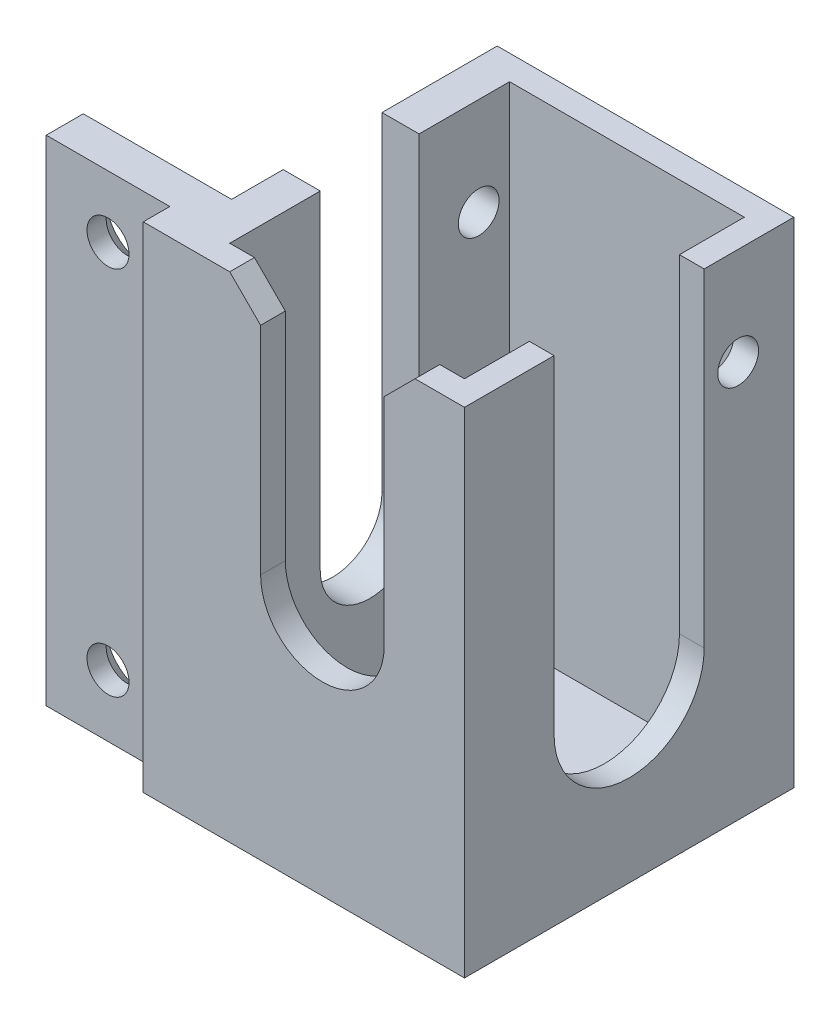
from build123d import *

# Parameters (mm, degrees)
SKETCH1_W                                       = 19
SKETCH1_H                                       = 22.65
BOSS_EXTRUDE1_DEPTH                             = 40
SKETCH2_W                                       = 3.46
SKETCH2_H                                       = 5.5
BOSS_EXTRUDE2_DEPTH                             = 0.7
CUT_EXTRUDE1_DEPTH                              = 3
CUT_EXTRUDE2_DEPTH                              = 2
CUT_EXTRUDE3_DEPTH                              = 2
CUT_EXTRUDE4_DEPTH                              = 12
CSK_FOR_M3_FLAT_HEAD_MACHINE_SCREW2_D           = 3.4
CSK_FOR_M3_FLAT_HEAD_MACHINE_SCREW2_DEPTH       = 14.978536948
CSK_FOR_M3_FLAT_HEAD_MACHINE_SCREW2_CSINK_D     = 6.3
CSK_FOR_M3_FLAT_HEAD_MACHINE_SCREW2_CSINK_ANGLE = 90
CSK_FOR_M3_FLAT_HEAD_MACHINE_SCREW2_TIP         = 1.021463052
CHAMFER3_SIZE                                   = 2.5
CUT_EXTRUDE5_DEPTH                              = 49.513458184
CUT_EXTRUDE5_DEPTH_BACK                         = 49.513458184
SKETCH14_R                                      = 1.65


with BuildPart() as part:
    # Sketch1 → Boss-Extrude1 (new body)
    with BuildSketch(Plane(origin=(0, 0, 0), x_dir=(1, 0, 0), z_dir=(0, 1, 0))):
        Polygon((-14.5, -13.325), (11.5, -13.325), (11.5, 13.325), (-12.5, 13.325), (-12.5, -8.175), (-24.5, -8.175), (-24.5, -11.175), (-14.5, -11.175), align=None)
        Rectangle(SKETCH1_W, SKETCH1_H, mode=Mode.SUBTRACT)
    extrude(amount=BOSS_EXTRUDE1_DEPTH)

    # Sketch2 → Boss-Extrude2 (add)
    with BuildSketch(Plane.XZ):
        Polygon((-14.5, 13.325), (-14.5, 11.175), (-24.5, 11.175), (-24.5, 8.175), (-12.5, 8.175), (-12.5, -13.325), (11.5, -13.325), (11.5, 13.325), align=None)
        Rectangle(SKETCH2_W, SKETCH2_H, mode=Mode.SUBTRACT)
    extrude(amount=-BOSS_EXTRUDE2_DEPTH)

    # Sketch3 → Cut-Extrude1 (cut)
    with BuildSketch(Plane.ZY.offset(12.5)):
        with BuildLine():
            Line((4, 46), (4, 13.43))
            ThreePointArc((4, 13.43), (0, 9.43), (-4, 13.43))
            Line((-4, 13.43), (-4, 46))
            ThreePointArc((-4, 46), (0, 50), (4, 46))
        make_face()
    extrude(amount=-CUT_EXTRUDE1_DEPTH, mode=Mode.SUBTRACT)

    # Sketch4 → Cut-Extrude2 (cut)
    with BuildSketch(Plane.ZY.offset(-9.5)):
        with BuildLine():
            Line((6.075, 43.362668218), (6.075, 13.43))
            ThreePointArc((6.075, 13.43), (0, 7.355), (-6.075, 13.43))
            Line((-6.075, 13.43), (-6.075, 43.362668218))
            ThreePointArc((-6.075, 43.362668218), (0, 49.437668218), (6.075, 43.362668218))
        make_face()
    extrude(amount=-CUT_EXTRUDE2_DEPTH, mode=Mode.SUBTRACT)

    # Sketch5 → Cut-Extrude3 (cut)
    with BuildSketch(Plane.XY.offset(13.325)):
        with BuildLine():
            Line((5, 47.930635506), (5, 20))
            ThreePointArc((5, 20), (0, 15), (-5, 20))
            Line((-5, 20), (-5, 47.930635506))
            ThreePointArc((-5, 47.930635506), (0, 52.930635506), (5, 47.930635506))
        make_face()
    extrude(amount=-CUT_EXTRUDE3_DEPTH, mode=Mode.SUBTRACT)

    # Sketch7 → Cut-Extrude4 (cut)
    with BuildSketch(Plane.ZY.offset(24.5)):
        Polygon((8.175, 30), (10.175, 28), (10.175, 12), (8.175, 10), align=None)
    extrude(amount=-CUT_EXTRUDE4_DEPTH, mode=Mode.SUBTRACT)

    # CSK for M3 Flat Head Machine Screw2
    with Locations(Plane(origin=(0, 0, 8.175), x_dir=(-1, 0, 0), z_dir=(0, 0, -1))):
        with Locations((19.5, 35), (19.5, 5)):
            CounterSinkHole(CSK_FOR_M3_FLAT_HEAD_MACHINE_SCREW2_D / 2, CSK_FOR_M3_FLAT_HEAD_MACHINE_SCREW2_CSINK_D / 2, depth=CSK_FOR_M3_FLAT_HEAD_MACHINE_SCREW2_DEPTH, counter_sink_angle=CSK_FOR_M3_FLAT_HEAD_MACHINE_SCREW2_CSINK_ANGLE)
            with Locations((0, 0, -(CSK_FOR_M3_FLAT_HEAD_MACHINE_SCREW2_DEPTH + CSK_FOR_M3_FLAT_HEAD_MACHINE_SCREW2_TIP / 2))):  # 118° drill point
                Cone(0, CSK_FOR_M3_FLAT_HEAD_MACHINE_SCREW2_D / 2, CSK_FOR_M3_FLAT_HEAD_MACHINE_SCREW2_TIP, mode=Mode.SUBTRACT)

    # Chamfer3
    chamfer3_edges = [part.edges().sort_by_distance(p)[0] for p in [
        (5, 40, 12.325),
        (-5, 40, 12.325),
    ]]
    chamfer(chamfer3_edges, length=CHAMFER3_SIZE)

    # Sketch14 → Cut-Extrude5 (cut, two sides: drawn at the far end of the back side and taken through both)
    with BuildSketch(Plane.ZY.offset(12.5).offset(-CUT_EXTRUDE5_DEPTH_BACK)):
        with Locations(Location((-8.825, 32.1, 0), (0, 0, 180))):
            Circle(SKETCH14_R)
    extrude(amount=CUT_EXTRUDE5_DEPTH + CUT_EXTRUDE5_DEPTH_BACK, mode=Mode.SUBTRACT)


solid = part.part
